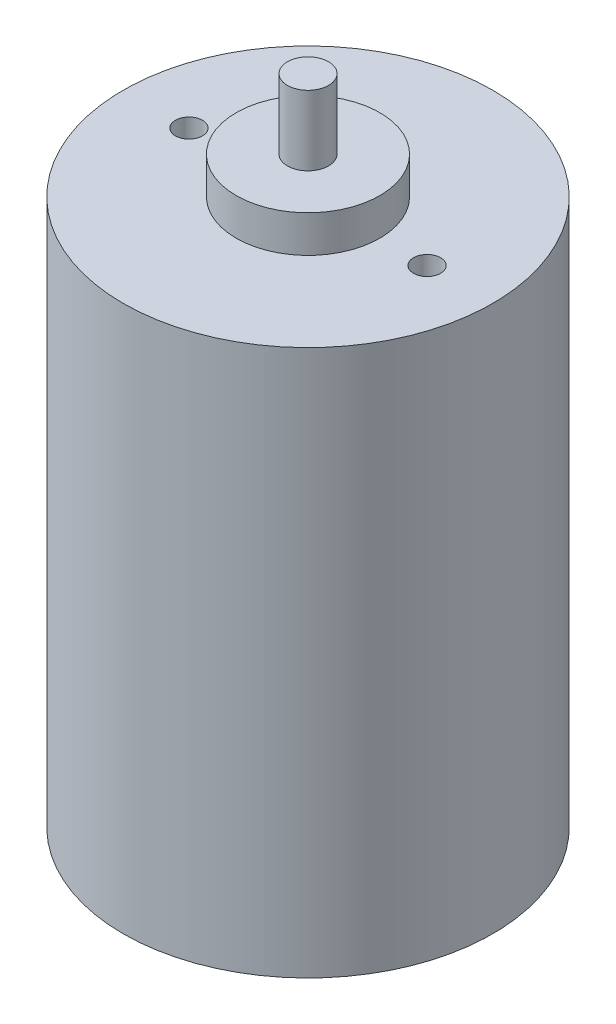
from build123d import *

# Parameters (mm, degrees)
SKETCH1_W                       = 2.499995
SKETCH1_H                       = 8.5000084
SKETCH1_W_2                     = 8.75000028
SKETCH1_H_2                     = 4.499991
TAP_DRILL_FOR_M4X0_7_TAP1_D     = 3.3
TAP_DRILL_FOR_M4X0_7_TAP1_DEPTH = 6.35
TAP_DRILL_FOR_M4X0_7_TAP1_TIP   = 0.991420021


with BuildPart() as part:
    # Sketch1 → Revolve1 (revolve)
    with BuildSketch(Plane.XY, mode=Mode.PRIVATE) as revolve1_sk:
        Polygon((8.75000028, 0), (0, 0), (0, -66.499994), (22.499955, -66.499994), (22.499955, 0), align=None)
        with Locations((1.2499975, 8.7499952)):
            Rectangle(SKETCH1_W, SKETCH1_H)
        with Locations((4.37500014, 2.2499955)):
            Rectangle(SKETCH1_W_2, SKETCH1_H_2)
    revolve(revolve1_sk.sketch.rotate(Axis((0, 8.775492653, 0), (0, -1, 0)), 90), axis=Axis((0, 8.775492653, 0), (0, -1, 0)))

    # Tap Drill for M4x0.7 Tap1
    with Locations(Plane(origin=(0, 0, 0), x_dir=(1, 0, 0), z_dir=(0, 1, 0))):
        with Locations((-14.499971, 0), (14.499971, 0)):
            Hole(TAP_DRILL_FOR_M4X0_7_TAP1_D / 2, depth=TAP_DRILL_FOR_M4X0_7_TAP1_DEPTH)
            with Locations((0, 0, -(TAP_DRILL_FOR_M4X0_7_TAP1_DEPTH + TAP_DRILL_FOR_M4X0_7_TAP1_TIP / 2))):  # 118° drill point
                Cone(0, TAP_DRILL_FOR_M4X0_7_TAP1_D / 2, TAP_DRILL_FOR_M4X0_7_TAP1_TIP, mode=Mode.SUBTRACT)


solid = part.part
